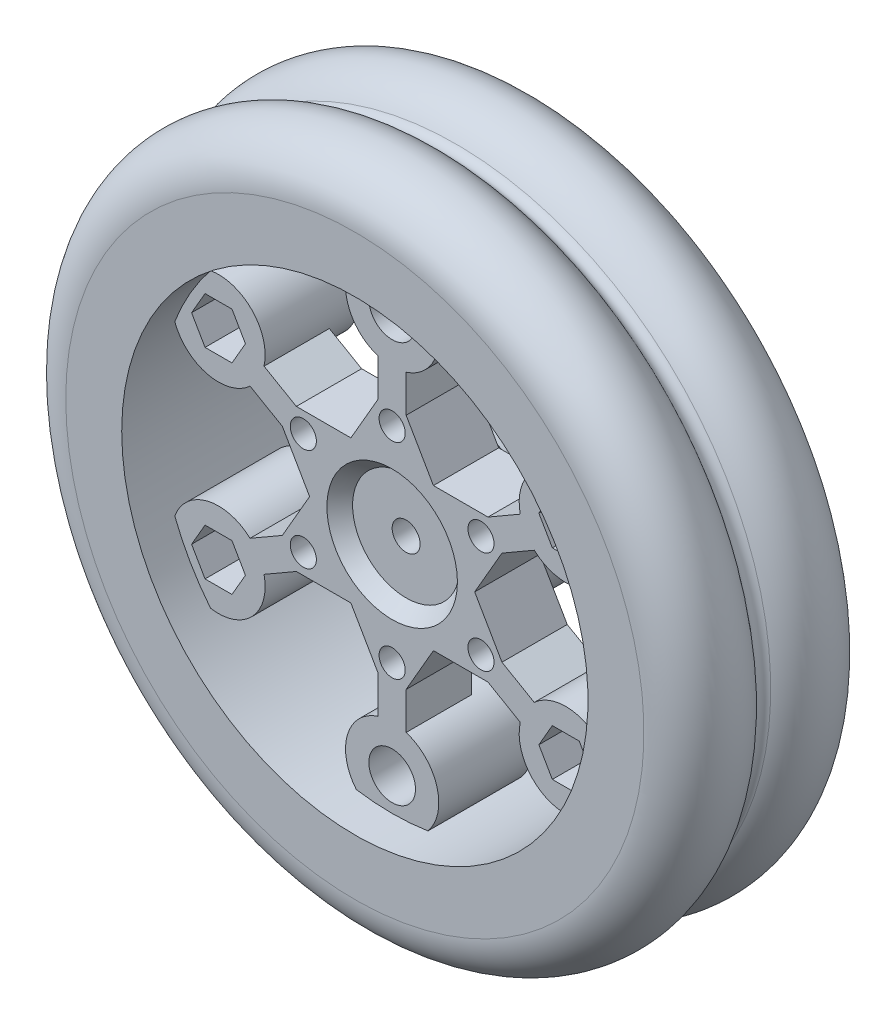
from build123d import *

# Parameters (mm, degrees)
SKETCH_2_R               = 5
EXTRUDE_1_DEPTH          = 10
PATTERN_CIRCULAR_1_COUNT = 6
EXTRUDE_2_DEPTH          = 7
SKETCH_4_R               = 1.4
CUT_EXTRUDE_1_DEPTH      = 53.086466711
PATTERN_CIRCULAR_2_COUNT = 6
SKETCH_5_R               = 9
EXTRUDE_3_DEPTH          = 5
SKETCH_7_R               = 7
CUT_EXTRUDE_3_DEPTH      = 1.5
CUT_EXTRUDE_3_DRAFT      = -40
SKETCH_8_R               = 1.5
CUT_EXTRUDE_4_DEPTH      = 53.93628259
SKETCH_10_R              = 1.25
CUT_EXTRUDE_6_DEPTH      = 54.366656391
PATTERN_CIRCULAR_3_COUNT = 6
SKETCH_11_R              = 2.5
CUT_EXTRUDE_7_DEPTH      = 54.366656391
PATTERN_CIRCULAR_4_COUNT = 2
CUT_EXTRUDE_8_DEPTH      = 8
PATTERN_CIRCULAR_5_COUNT = 6
CUT_EXTRUDE_9_DEPTH      = 8


with BuildPart() as part:
    # 草图1 → 旋转1 (revolve)
    with BuildSketch(Plane(origin=(0, 0, 0), x_dir=(1, 0, 0), z_dir=(0, 1, 0)), mode=Mode.PRIVATE) as revolve_1_sk:
        with BuildLine():
            Line((25, 10), (25, -10))
            Line((25, -10), (31, -10))
            ThreePointArc((31, -10), (35.787135539, -6.443375673), (33.763853992, -0.833333333))
            ThreePointArc((33.763853992, -0.833333333), (33.31662479, 0), (33.763853992, 0.833333333))
            ThreePointArc((33.763853992, 0.833333333), (35.787135539, 6.443375673), (31, 10))
            Line((31, 10), (25, 10))
        make_face()
    revolve(revolve_1_sk.sketch.rotate(Axis((0, 0, -146.934042126), (0, 0, 1)), 180), axis=Axis((0, 0, -146.934042126), (0, 0, 1)))

    # 草图2 → 凸台-拉伸1 (add)
    with BuildSketch(Plane.XY.offset(6)):
        with Locations((0, 21.5)):
            Circle(SKETCH_2_R)
    extrude_1 = extrude(amount=-EXTRUDE_1_DEPTH)

    # 阵列(圆周)1: 凸台-拉伸1 ×6 about axis
    pattern_circular_1_axis = Axis((0, 0, 0), (0, 0, 1))
    for i in range(1, PATTERN_CIRCULAR_1_COUNT):
        add(extrude_1.rotate(pattern_circular_1_axis, i * 360 / PATTERN_CIRCULAR_1_COUNT))

    # 草图3 → 凸台-拉伸2 (add)
    with BuildSketch(Plane.XY.offset(6)):
        with BuildLine():
            Line((-8.849844437, 0), (-11.774766656, -5.066113891))
            Line((-11.774766656, -5.066113891), (-15.238868271, -7.066113891))
            ThreePointArc((-15.238868271, -7.066113891), (-14.289419162, -8.25), (-13.738868271, -9.664190102))
            Line((-13.738868271, -9.664190102), (-10.274766656, -7.664190102))
            Line((-10.274766656, -7.664190102), (-4.424922219, -7.664190102))
            Line((-4.424922219, -7.664190102), (-1.5, -12.730303993))
            Line((-1.5, -12.730303993), (-1.5, -16.730303993))
            ThreePointArc((-1.5, -16.730303993), (0, -16.5), (1.5, -16.730303993))
            Line((1.5, -16.730303993), (1.5, -12.730303993))
            Line((1.5, -12.730303993), (4.424922219, -7.664190102))
            Line((4.424922219, -7.664190102), (10.274766656, -7.664190102))
            Line((10.274766656, -7.664190102), (13.738868271, -9.664190102))
            ThreePointArc((13.738868271, -9.664190102), (14.289419162, -8.25), (15.238868271, -7.066113891))
            Line((15.238868271, -7.066113891), (11.774766656, -5.066113891))
            Line((11.774766656, -5.066113891), (8.849844437, 0))
            Line((8.849844437, 0), (11.774766656, 5.066113891))
            Line((11.774766656, 5.066113891), (15.238868271, 7.066113891))
            ThreePointArc((15.238868271, 7.066113891), (14.289419162, 8.25), (13.738868271, 9.664190102))
            Line((13.738868271, 9.664190102), (10.274766656, 7.664190102))
            Line((10.274766656, 7.664190102), (4.424922219, 7.664190102))
            Line((4.424922219, 7.664190102), (1.5, 12.730303993))
            Line((1.5, 12.730303993), (1.5, 16.730303993))
            ThreePointArc((1.5, 16.730303993), (0, 16.5), (-1.5, 16.730303993))
            Line((-1.5, 16.730303993), (-1.5, 12.730303993))
            Line((-1.5, 12.730303993), (-4.424922219, 7.664190102))
            Line((-4.424922219, 7.664190102), (-10.274766656, 7.664190102))
            Line((-10.274766656, 7.664190102), (-13.738868271, 9.664190102))
            ThreePointArc((-13.738868271, 9.664190102), (-14.289419162, 8.25), (-15.238868271, 7.066113891))
            Line((-15.238868271, 7.066113891), (-11.774766656, 5.066113891))
            Line((-11.774766656, 5.066113891), (-8.849844437, 0))
        make_face()
    extrude(amount=-EXTRUDE_2_DEPTH)

    # 草图4 → 切除-拉伸1 (cut, through all)
    with BuildSketch(Plane(origin=(0, 0, -1), x_dir=(-1, 0, 0), z_dir=(0, 0, -1))):
        with Locations((0, 11)):
            Circle(SKETCH_4_R)
    cut_extrude_1 = extrude(amount=-CUT_EXTRUDE_1_DEPTH, mode=Mode.SUBTRACT)

    # 阵列(圆周)2: 切除-拉伸1 ×6 about axis
    pattern_circular_2_axis = Axis((0, 0, 0), (0, 0, 1))
    for i in range(1, PATTERN_CIRCULAR_2_COUNT):
        add(cut_extrude_1.rotate(pattern_circular_2_axis, i * 360 / PATTERN_CIRCULAR_2_COUNT), mode=Mode.SUBTRACT)

    # 草图5 → 凸台-拉伸3 (add)
    with BuildSketch(Plane(origin=(0, 0, -1), x_dir=(-1, 0, 0), z_dir=(0, 0, -1))):
        with Locations(Location((0, 0, 0), (0, 0, 181.616426084))):
            Circle(SKETCH_5_R)
    extrude(amount=EXTRUDE_3_DEPTH)


with BuildPart() as cut_extrude_3_tool:
    # 草图7 → 切除-拉伸3 (with draft: the straight prism first)
    with BuildSketch(Plane.XY.offset(6)):
        Circle(SKETCH_7_R)
    extrude(amount=-CUT_EXTRUDE_3_DEPTH)
    # 切除-拉伸3: the draft: its side faces are tilted about the plane it starts from
    cut_extrude_3_sides = [cut_extrude_3_tool.faces().sort_by_distance(p)[0] for p in [
        (-7, 0, 5.25),
    ]]
    draft(cut_extrude_3_sides, Plane.XY.offset(6), CUT_EXTRUDE_3_DRAFT)


with BuildPart() as part_1:
    add(part.part)

    # 切除-拉伸3: cut by cut_extrude_3_tool
    add(cut_extrude_3_tool.part, mode=Mode.SUBTRACT)

    # 草图8 → 切除-拉伸4 (cut, through all)
    with BuildSketch(Plane.XY.offset(4.5)):
        Circle(SKETCH_8_R)
    extrude(amount=-CUT_EXTRUDE_4_DEPTH, mode=Mode.SUBTRACT)

    # 草图10 → 切除-拉伸6 (cut, through all)
    with BuildSketch(Plane.XY.offset(6)):
        with Locations((0, 21.5)):
            Circle(SKETCH_10_R)
    cut_extrude_6 = extrude(amount=-CUT_EXTRUDE_6_DEPTH, mode=Mode.SUBTRACT)

    # 阵列(圆周)3: 切除-拉伸6 ×6 about axis
    pattern_circular_3_axis = Axis((0, 0, 0), (0, 0, 1))
    for i in range(1, PATTERN_CIRCULAR_3_COUNT):
        add(cut_extrude_6.rotate(pattern_circular_3_axis, i * 360 / PATTERN_CIRCULAR_3_COUNT), mode=Mode.SUBTRACT)

    # 草图11 → 切除-拉伸7 (cut, through all)
    with BuildSketch(Plane.XY.offset(6)):
        with Locations((0, 21.5)):
            Circle(SKETCH_11_R)
    cut_extrude_7 = extrude(amount=-CUT_EXTRUDE_7_DEPTH, mode=Mode.SUBTRACT)

    # 阵列(圆周)4: 切除-拉伸7 ×2 about axis
    pattern_circular_4_axis = Axis((0, 0, 0), (0, 0, 1))
    for i in range(1, PATTERN_CIRCULAR_4_COUNT):
        add(cut_extrude_7.rotate(pattern_circular_4_axis, i * 360 / PATTERN_CIRCULAR_4_COUNT), mode=Mode.SUBTRACT)

    # 草图12 → 切除-拉伸8 (cut)
    with BuildSketch(Plane.XY.offset(6)):
        Polygon((20.062921854, 8.25), (21.506297527, 10.75), (20.062921854, 13.25), (17.176170508, 13.25), (15.732794835, 10.75), (17.176170508, 8.25), align=None)
    cut_extrude_8 = extrude(amount=-CUT_EXTRUDE_8_DEPTH, mode=Mode.SUBTRACT)

    # 阵列(圆周)5: 切除-拉伸8 ×6 about axis, 2 skipped
    pattern_circular_5_axis = Axis((0, 0, 0), (0, 0, -1))
    add([cut_extrude_8.rotate(pattern_circular_5_axis, i * 360 / PATTERN_CIRCULAR_5_COUNT) for i in range(1, PATTERN_CIRCULAR_5_COUNT) if i not in (2, 5)], mode=Mode.SUBTRACT)

    # 草图14 → 切除-拉伸9 (cut)
    with BuildSketch(Plane(origin=(0, 0, -6), x_dir=(-1, 0, 0), z_dir=(0, 0, -1))):
        Polygon((0, 6.92820323), (-6, 3.464101615), (-6, -3.464101615), (0, -6.92820323), (6, -3.464101615), (6, 3.464101615), align=None)
    extrude(amount=-CUT_EXTRUDE_9_DEPTH, mode=Mode.SUBTRACT)


solid = part_1.part
